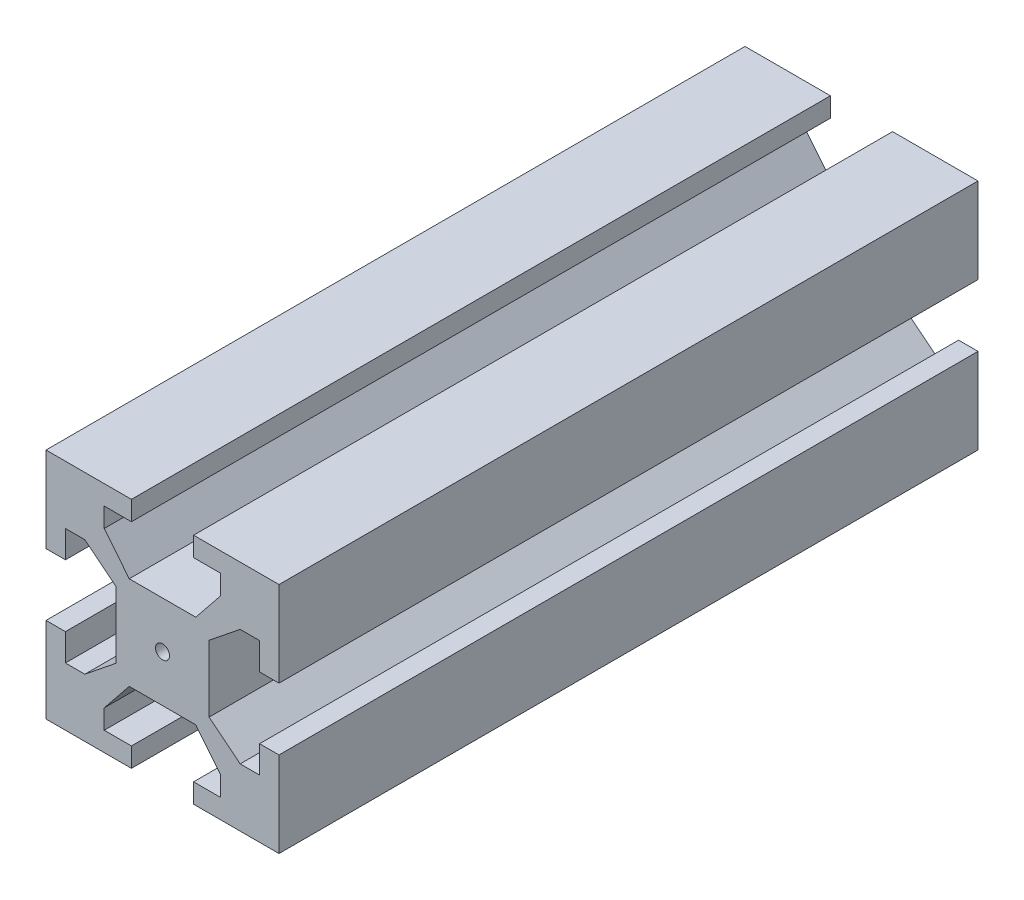
from build123d import *

# Parameters (mm, degrees)
SKETCH1_R           = 1.5
BOSS_EXTRUDE1_DEPTH = 75


with BuildPart() as part:
    # Sketch1 → Boss-Extrude1 (new, symmetric)
    with BuildSketch(Plane.XY):
        Polygon((25, 25), (6.666666667, 25), (6.666666667, 20.833333333), (12.5, 20.833333333), (12.5, 16.666666667), (7.142857143, 10), (-7.142857143, 10), (-12.5, 16.666666667), (-12.5, 20.833333333), (-6.666666667, 20.833333333), (-6.666666667, 25), (-25, 25), (-25, 6.666666667), (-20.833333333, 6.666666667), (-20.833333333, 12.5), (-16.666666667, 12.5), (-10, 7.142857143), (-10, -7.142857143), (-16.666666667, -12.5), (-20.833333333, -12.5), (-20.833333333, -6.666666667), (-25, -6.666666667), (-25, -25), (-6.666666667, -25), (-6.666666667, -20.833333333), (-12.5, -20.833333333), (-12.5, -16.666666667), (-7.142857143, -10), (7.142857143, -10), (12.5, -16.666666667), (12.5, -20.833333333), (6.666666667, -20.833333333), (6.666666667, -25), (25, -25), (25, -6.666666667), (20.833333333, -6.666666667), (20.833333333, -12.5), (16.666666667, -12.5), (10, -7.142857143), (10, 7.142857143), (16.666666667, 12.5), (20.833333333, 12.5), (20.833333333, 6.666666667), (25, 6.666666667), align=None)
        Circle(SKETCH1_R, mode=Mode.SUBTRACT)
    extrude(amount=BOSS_EXTRUDE1_DEPTH, both=True)


solid = part.part
